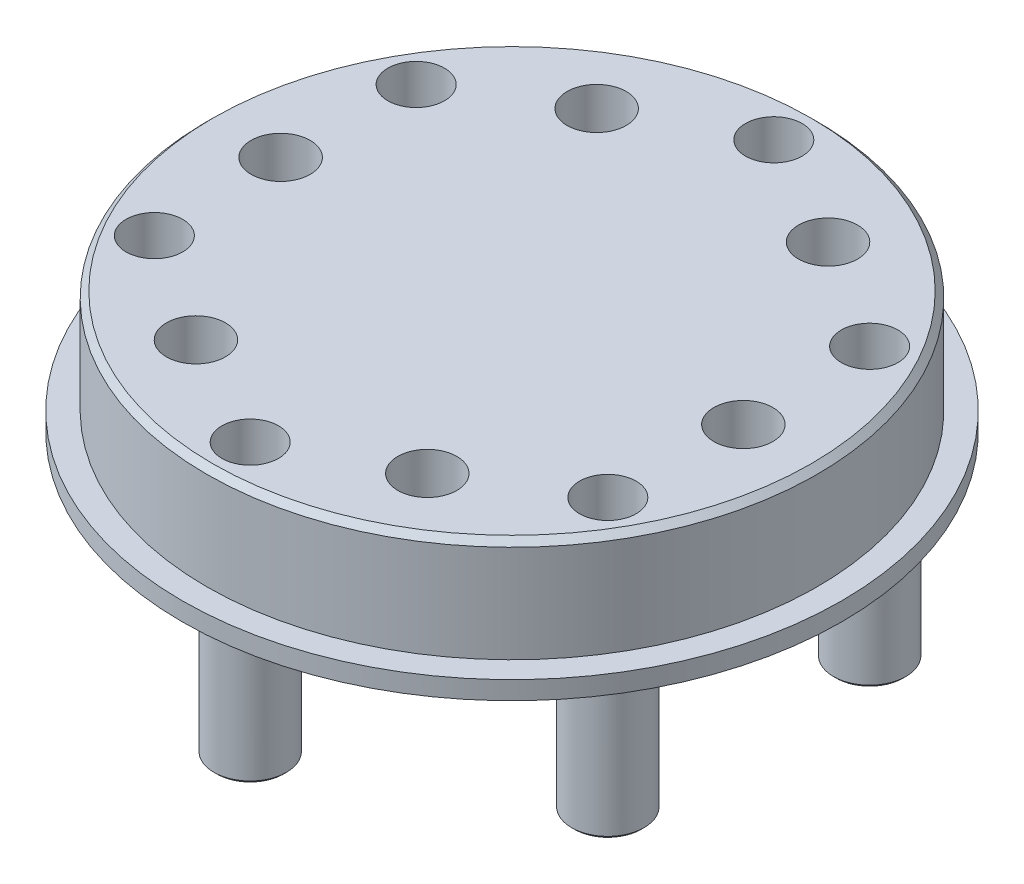
from build123d import *
from build123d.topology import SkipClean

# Parameters (mm, degrees)
SKETCH2_R            = 25.075
SKETCH2_R_2          = 1.35
SKETCH2_R_3          = 11.025
BOSS_EXTRUDE1_DEPTH  = 10
SKETCH3_R            = 2.325
CUT_EXTRUDE2_DEPTH   = 5.75
SKETCH11_R           = 27.075
SKETCH11_R_2         = 25.075
BOSS_EXTRUDE6_DEPTH  = 1.5
SKETCH12_R           = 11.025
SKETCH12_R_2         = 10.025
BOSS_EXTRUDE7_DEPTH  = 1.5
SKETCH13_R           = 2.425
CUT_EXTRUDE7_DEPTH   = 6
CIRPATTERN4_COUNT    = 6
BOSS_EXTRUDE8_START  = 12.25
SKETCH16_R           = 2.975
SKETCH16_R_2         = 1.35
BOSS_EXTRUDE8_DEPTH  = 12.25
SKETCH17_R           = 11.025
SKETCH17_R_2         = 10.025
BOSS_EXTRUDE9_DEPTH  = 1.5
CHAMFER1_SIZE        = 0.25
CHAMFER2_SIZE        = 0.5
BOSS_EXTRUDE10_START = -2
SKETCH18_R           = 10.025
BOSS_EXTRUDE10_DEPTH = 2


with BuildPart() as part:
    # Sketch2 → Boss-Extrude1 (new body)
    with BuildSketch(Plane(origin=(0, 0, 0), x_dir=(1, 0, 0), z_dir=(0, 1, 0))):
        with Locations(Location((0, 0, 0), (0, 0, 270))):
            Circle(SKETCH2_R)
        with Locations(Location((0, 21.5, 0), (0, 0, 270))):
            Circle(SKETCH2_R_2, mode=Mode.SUBTRACT)
        with Locations(Location((18.619546181, 10.75, 0), (0, 0, 270))):
            Circle(SKETCH2_R_2, mode=Mode.SUBTRACT)
        with Locations(Location((18.619546181, -10.75, 0), (0, 0, 270))):
            Circle(SKETCH2_R_2, mode=Mode.SUBTRACT)
        with Locations(Location((0, -21.5, 0), (0, 0, 270))):
            Circle(SKETCH2_R_2, mode=Mode.SUBTRACT)
        with Locations(Location((-18.619546181, -10.75, 0), (0, 0, 270))):
            Circle(SKETCH2_R_2, mode=Mode.SUBTRACT)
        with Locations(Location((-18.619546181, 10.75, 0), (0, 0, 270))):
            Circle(SKETCH2_R_2, mode=Mode.SUBTRACT)
        with Locations(Location((0, 0, 0), (0, 0, 270))):
            Circle(SKETCH2_R_3, mode=Mode.SUBTRACT)
    extrude(amount=BOSS_EXTRUDE1_DEPTH)

    # Sketch3 → Cut-Extrude2 (cut)
    with BuildSketch(Plane(origin=(0, 10, 0), x_dir=(1, 0, 0), z_dir=(0, 1, 0))):
        with Locations(Location((0, 21.5, 0), (0, 0, 270))):
            Circle(SKETCH3_R)
        with Locations(Location((18.619546181, 10.75, 0), (0, 0, 270))):
            Circle(SKETCH3_R)
        with Locations(Location((18.619546181, -10.75, 0), (0, 0, 270))):
            Circle(SKETCH3_R)
        with Locations(Location((0, -21.5, 0), (0, 0, 270))):
            Circle(SKETCH3_R)
        with Locations(Location((-18.619546181, -10.75, 0), (0, 0, 270))):
            Circle(SKETCH3_R)
        with Locations(Location((-18.619546181, 10.75, 0), (0, 0, 270))):
            Circle(SKETCH3_R)
    extrude(amount=-CUT_EXTRUDE2_DEPTH, mode=Mode.SUBTRACT)

    # Sketch11 → Boss-Extrude6 (add)
    with BuildSketch(Plane(origin=(0, 0, 0), x_dir=(1, 0, 0), z_dir=(0, 1, 0))):
        with Locations(Location((0, 0, 0), (0, 0, 270))):
            Circle(SKETCH11_R)
        with Locations(Location((0, 0, 0), (0, 0, 270))):
            Circle(SKETCH11_R_2, mode=Mode.SUBTRACT)
    extrude(amount=BOSS_EXTRUDE6_DEPTH)

    # Sketch12 → Boss-Extrude7 (add)
    with BuildSketch(Plane(origin=(0, 7, 0), x_dir=(1, 0, 0), z_dir=(0, 1, 0))):
        with Locations(Location((0, 0, 0), (0, 0, 270))):
            Circle(SKETCH12_R)
        with Locations(Location((0, 0, 0), (0, 0, 270))):
            Circle(SKETCH12_R_2, mode=Mode.SUBTRACT)
    extrude(amount=BOSS_EXTRUDE7_DEPTH)

    # Sketch13 → Cut-Extrude7 (cut)
    with BuildSketch(Plane(origin=(0, 10, 0), x_dir=(1, 0, 0), z_dir=(0, 1, 0))):
        with Locations(Location((-9.5, 16.454482672, 0), (0, 0, 270))):
            Circle(SKETCH13_R)
    cut_extrude7 = extrude(amount=-CUT_EXTRUDE7_DEPTH, mode=Mode.SUBTRACT)

    # CirPattern4: Cut-Extrude7 ×6 about axis
    cirpattern4_axis = Axis((0, 0, 0), (0, 1, 0))
    for i in range(1, CIRPATTERN4_COUNT):
        add(cut_extrude7.rotate(cirpattern4_axis, i * 360 / CIRPATTERN4_COUNT), mode=Mode.SUBTRACT)

    # Sketch16 → Boss-Extrude8 (add)
    # profile 1 of 6: a face of its own
    with SkipClean():  # the faces are left unmerged after this step: merging them gives an invalid solid
        with BuildSketch(Plane.XZ.offset(BOSS_EXTRUDE8_START)):
            with Locations(Location((0, -21.5, 0), (0, 0, 90))):
                Circle(SKETCH16_R)
            with Locations(Location((0, -21.5, 0), (0, 0, 270))):
                Circle(SKETCH16_R_2, mode=Mode.SUBTRACT)
        # profile 2 of 6: a face of its own
        with BuildSketch(Plane.XZ.offset(BOSS_EXTRUDE8_START)):
            with Locations(Location((-18.619546181, -10.75, 0), (0, 0, 90))):
                Circle(SKETCH16_R)
            with Locations(Location((-18.619546181, -10.75, 0), (0, 0, 270))):
                Circle(SKETCH16_R_2, mode=Mode.SUBTRACT)
        # profile 3 of 6: a face of its own
        with BuildSketch(Plane.XZ.offset(BOSS_EXTRUDE8_START)):
            with Locations(Location((-18.619546181, 10.75, 0), (0, 0, 90))):
                Circle(SKETCH16_R)
            with Locations(Location((-18.619546181, 10.75, 0), (0, 0, 270))):
                Circle(SKETCH16_R_2, mode=Mode.SUBTRACT)
        # profile 4 of 6: a face of its own
        with BuildSketch(Plane.XZ.offset(BOSS_EXTRUDE8_START)):
            with Locations(Location((0, 21.5, 0), (0, 0, 90))):
                Circle(SKETCH16_R)
            with Locations(Location((0, 21.5, 0), (0, 0, 270))):
                Circle(SKETCH16_R_2, mode=Mode.SUBTRACT)
        # profile 5 of 6: a face of its own
        with BuildSketch(Plane.XZ.offset(BOSS_EXTRUDE8_START)):
            with Locations(Location((18.619546181, 10.75, 0), (0, 0, 90))):
                Circle(SKETCH16_R)
            with Locations(Location((18.619546181, 10.75, 0), (0, 0, 270))):
                Circle(SKETCH16_R_2, mode=Mode.SUBTRACT)
        # profile 6 of 6: a face of its own
        with BuildSketch(Plane.XZ.offset(BOSS_EXTRUDE8_START)):
            with Locations(Location((18.619546181, -10.75, 0), (0, 0, 90))):
                Circle(SKETCH16_R)
            with Locations(Location((18.619546181, -10.75, 0), (0, 0, 270))):
                Circle(SKETCH16_R_2, mode=Mode.SUBTRACT)
        extrude(amount=-BOSS_EXTRUDE8_DEPTH)

    # Sketch17 → Boss-Extrude9 (add)
    with SkipClean():  # the faces are left unmerged after this step: merging them gives an invalid solid
        with BuildSketch(Plane(origin=(0, 8.5, 0), x_dir=(1, 0, 0), z_dir=(0, 1, 0))):
            with Locations(Location((0, 0, 0), (0, 0, 270))):
                Circle(SKETCH17_R)
            with Locations(Location((0, 0, 0), (0, 0, 270))):
                Circle(SKETCH17_R_2, mode=Mode.SUBTRACT)
        extrude(amount=BOSS_EXTRUDE9_DEPTH)

    # Chamfer1
    chamfer1_edges = [part.edges().sort_by_distance(p)[0] for p in [
        (0, -12.25, -24.475),
        (18.619546181, -12.25, -13.725),
        (18.619546181, -12.25, 7.775),
        (0, -12.25, 18.525),
        (-18.619546181, -12.25, 7.775),
        (-18.619546181, -12.25, -13.725),
    ]]
    chamfer(chamfer1_edges, length=CHAMFER1_SIZE)

    # Chamfer2
    chamfer2_edges = [part.edges().sort_by_distance(p)[0] for p in [
        (0, 10, -25.075),
        (0, 0, -11.025),
    ]]
    chamfer(chamfer2_edges, length=CHAMFER2_SIZE)

    # Sketch18 → Boss-Extrude10 (add)
    with BuildSketch(Plane(origin=(0, 10, 0), x_dir=(1, 0, 0), z_dir=(0, 1, 0)).offset(BOSS_EXTRUDE10_START)):
        with Locations(Location((0, 0, 0), (0, 0, 270))):
            Circle(SKETCH18_R)
    extrude(amount=BOSS_EXTRUDE10_DEPTH)


solid = part.part
